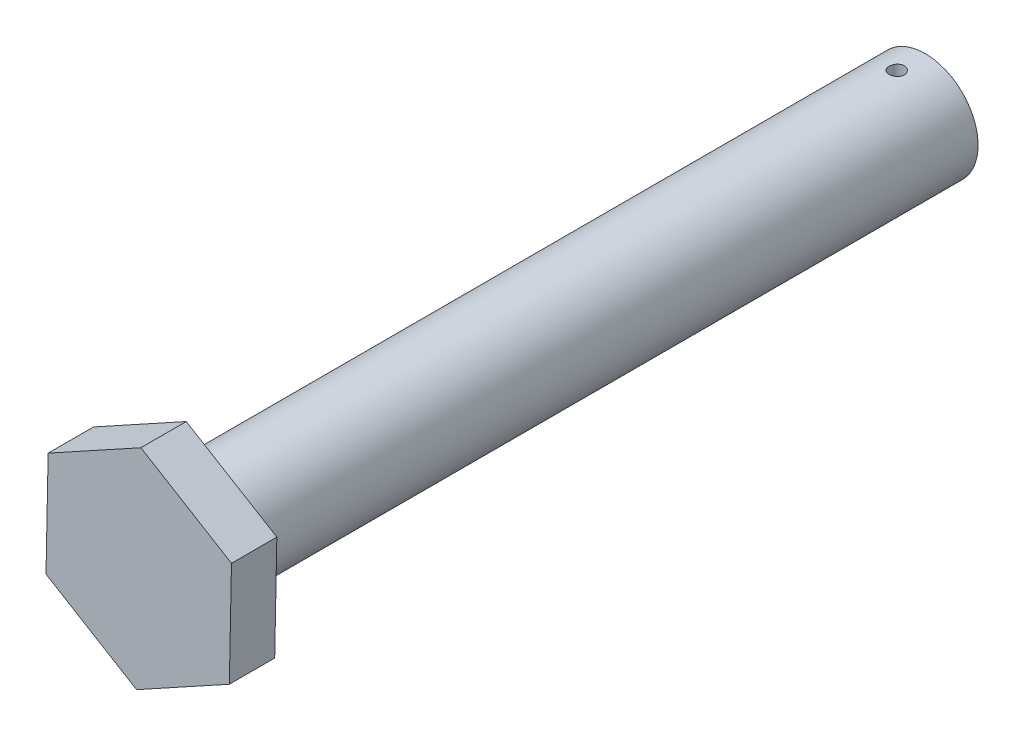
from build123d import *

# Parameters (mm, degrees)
SKETCH1_R               = 3.5
BOSS_EXTRUDE1_DEPTH     = 46
BOSS_EXTRUDE2_DEPTH     = 3
BOSS_EXTRUDE3_START     = 3
SKETCH3_R               = 3.5
BOSS_EXTRUDE3_DEPTH     = 3
CUT_EXTRUDE2_DEPTH      = 13
CUT_EXTRUDE2_DEPTH_BACK = 15
SKETCH4_R               = 0.5


with BuildPart() as part:
    # Sketch1 → Boss-Extrude1 (new body)
    with BuildSketch(Plane.XY):
        Circle(SKETCH1_R)
    extrude(amount=BOSS_EXTRUDE1_DEPTH)

    # Sketch2 → Boss-Extrude2 (add)
    with BuildSketch(Plane.XY.offset(46)):
        Polygon((0.14203789, 6.998558797), (-5.989910763, 3.62228782), (-6.131948653, -3.376270977), (-0.14203789, -6.998558797), (5.989910763, -3.62228782), (6.131948653, 3.376270977), align=None)
    extrude(amount=BOSS_EXTRUDE2_DEPTH)

    # Sketch3 → Boss-Extrude3 (add)
    with BuildSketch(Plane(origin=(0, 0, 0), x_dir=(-1, 0, 0), z_dir=(0, 0, -1)).offset(BOSS_EXTRUDE3_START)):
        Circle(SKETCH3_R)
    extrude(amount=-BOSS_EXTRUDE3_DEPTH)

    # Sketch4 → Cut-Extrude2 (cut, two sides: drawn at the far end of the back side and taken through both)
    with BuildSketch(Plane(origin=(0, 0, 0), x_dir=(1, 0, 0), z_dir=(0, 1, 0)).offset(-CUT_EXTRUDE2_DEPTH_BACK)):
        with Locations(Location((0, 1.112079682, 0), (0, 0, 270))):
            Circle(SKETCH4_R)
    extrude(amount=CUT_EXTRUDE2_DEPTH + CUT_EXTRUDE2_DEPTH_BACK, mode=Mode.SUBTRACT)


solid = part.part
